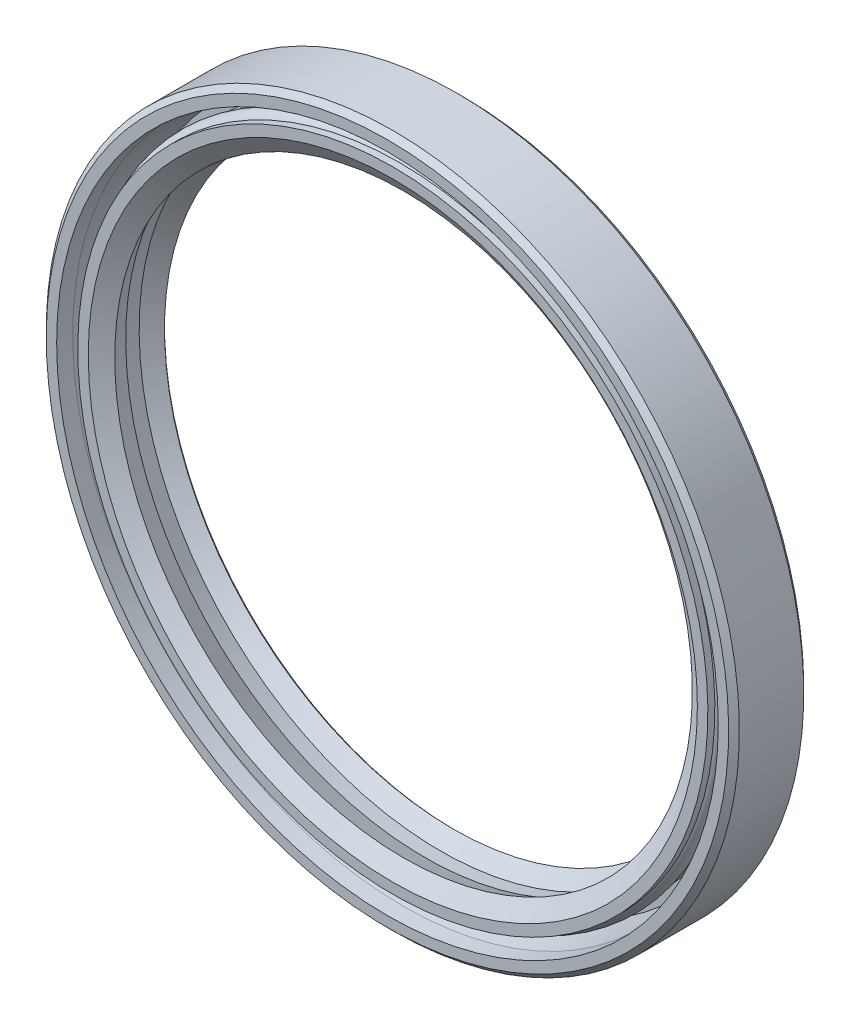
from build123d import *


with BuildPart() as part:
    # 스케치1 → 회전1 (revolve)
    with BuildSketch(Plane(origin=(0, 0, 0), x_dir=(0, 0, -1), z_dir=(1, 0, 0))):
        with BuildLine():
            Line((-10.214285714, 57.272727273), (-2.785714286, 56.363636364))
            Line((-2.785714286, 56.363636364), (-2.785714286, 54.545454545))
            Line((-2.785714286, 54.545454545), (-7.711122642, 54.545454545))
            ThreePointArc((-7.711122642, 54.545454545), (-9.285714286, 55.454545455), (-10.860305929, 54.545454545))
            Line((-10.860305929, 54.545454545), (-12.071428571, 54.545454545))
            Line((-12.071428571, 54.545454545), (-12.071428571, 52.727272727))
            Line((-12.071428571, 52.727272727), (-10.214285714, 50))
            Line((-10.214285714, 50), (-6.5, 51.818181818))
            Line((-6.5, 51.818181818), (-3.796015479, 52.196361472))
            Line((-3.796015479, 52.196361472), (-1.599654007, 50))
            Line((-1.599654007, 50), (-1.181818182, 50.417835825))
            Line((-1.181818182, 50.417835825), (-1.924421913, 52.458122809))
            Line((-1.924421913, 52.458122809), (0, 52.727272727))
            Line((0, 52.727272727), (0, 59.071428571))
            Line((0, 59.071428571), (-0.928571429, 60))
            Line((-0.928571429, 60), (-12.071428571, 60))
            Line((-12.071428571, 60), (-13, 59.071428571))
            Line((-13, 59.071428571), (-13, 57.272727273))
            Line((-13, 57.272727273), (-10.214285714, 57.272727273))
        make_face()
    revolve(axis=Axis((0, 0, 0), (0, 0, 1)))


solid = part.part
